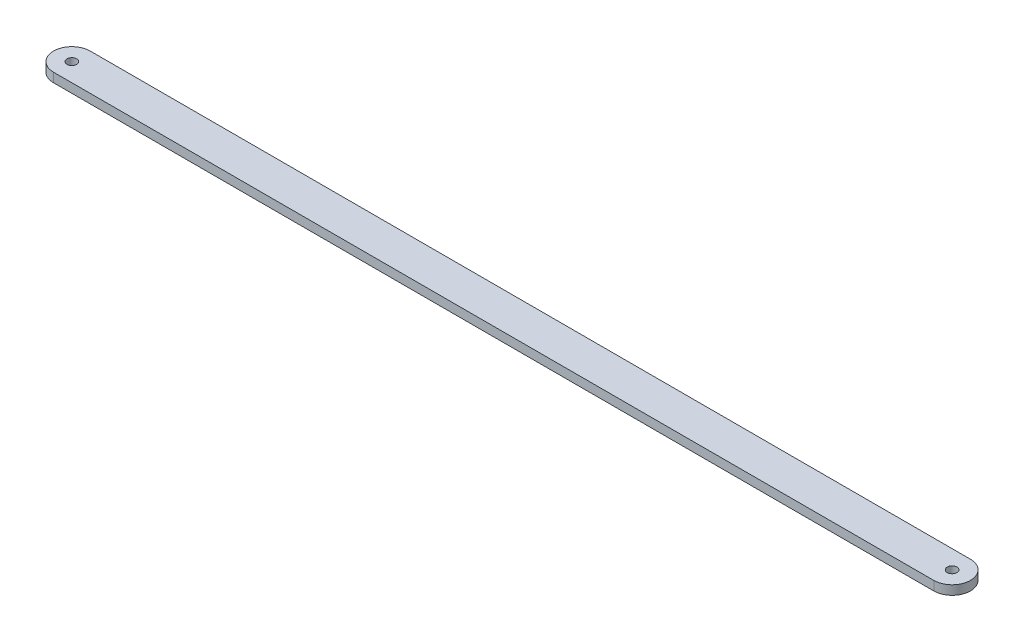
from build123d import *

# Parameters (mm, degrees)
SKETCH1_R           = 3.3655
BOSS_EXTRUDE1_DEPTH = 6.35


with BuildPart() as part:
    # Sketch1 → Boss-Extrude1 (new body)
    with BuildSketch(Plane(origin=(0, 0, 0), x_dir=(1, 0, 0), z_dir=(0, 1, 0))):
        with BuildLine():
            Line((-304.8, 12.7), (304.8, 12.7))
            ThreePointArc((304.8, 12.7), (317.5, 0), (304.8, -12.7))
            Line((304.8, -12.7), (-304.8, -12.7))
            ThreePointArc((-304.8, -12.7), (-317.5, 0), (-304.8, 12.7))
        make_face()
        with Locations(Location((304.8, 0, 0), (0, 0, 270))):
            Circle(SKETCH1_R, mode=Mode.SUBTRACT)
        with Locations(Location((-304.8, 0, 0), (0, 0, 270))):
            Circle(SKETCH1_R, mode=Mode.SUBTRACT)
    extrude(amount=BOSS_EXTRUDE1_DEPTH)


solid = part.part
